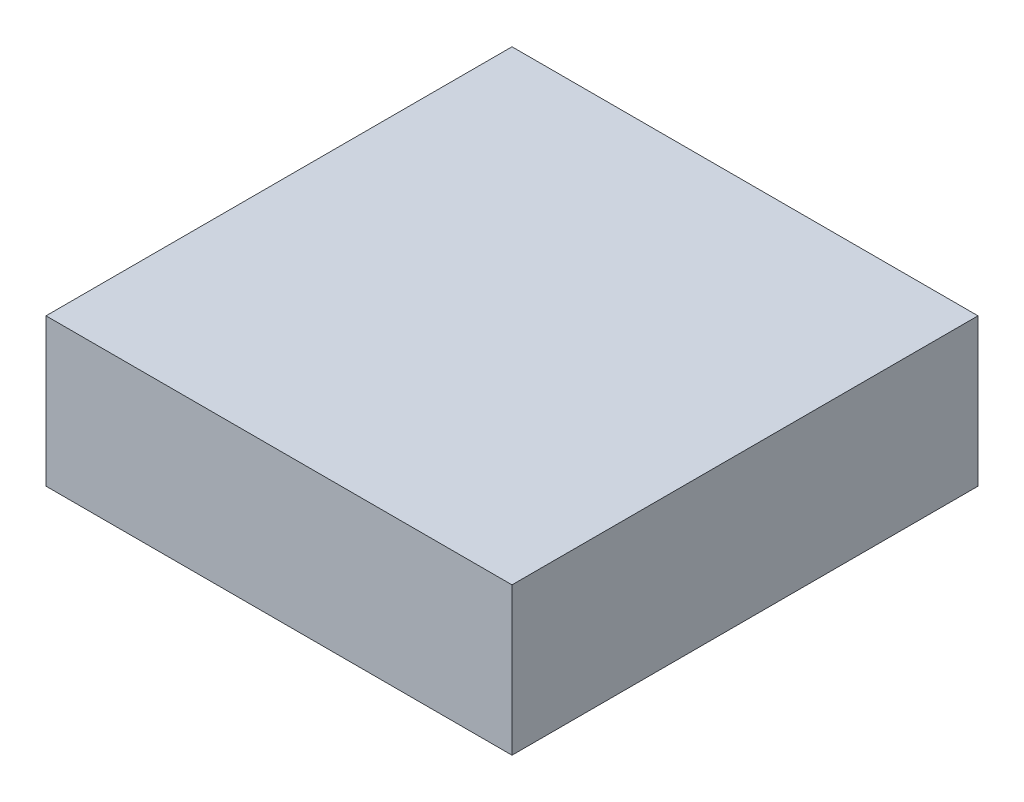
from build123d import *

# Parameters (mm, degrees)
SKETCH1_W           = 120
SKETCH1_H           = 120
BOSS_EXTRUDE1_DEPTH = 38


with BuildPart() as part:
    # Sketch1 → Boss-Extrude1 (new body)
    with BuildSketch(Plane(origin=(0, 0, 0), x_dir=(1, 0, 0), z_dir=(0, 1, 0))):
        with Locations((60, 60)):
            Rectangle(SKETCH1_W, SKETCH1_H)
    extrude(amount=BOSS_EXTRUDE1_DEPTH)


solid = part.part
